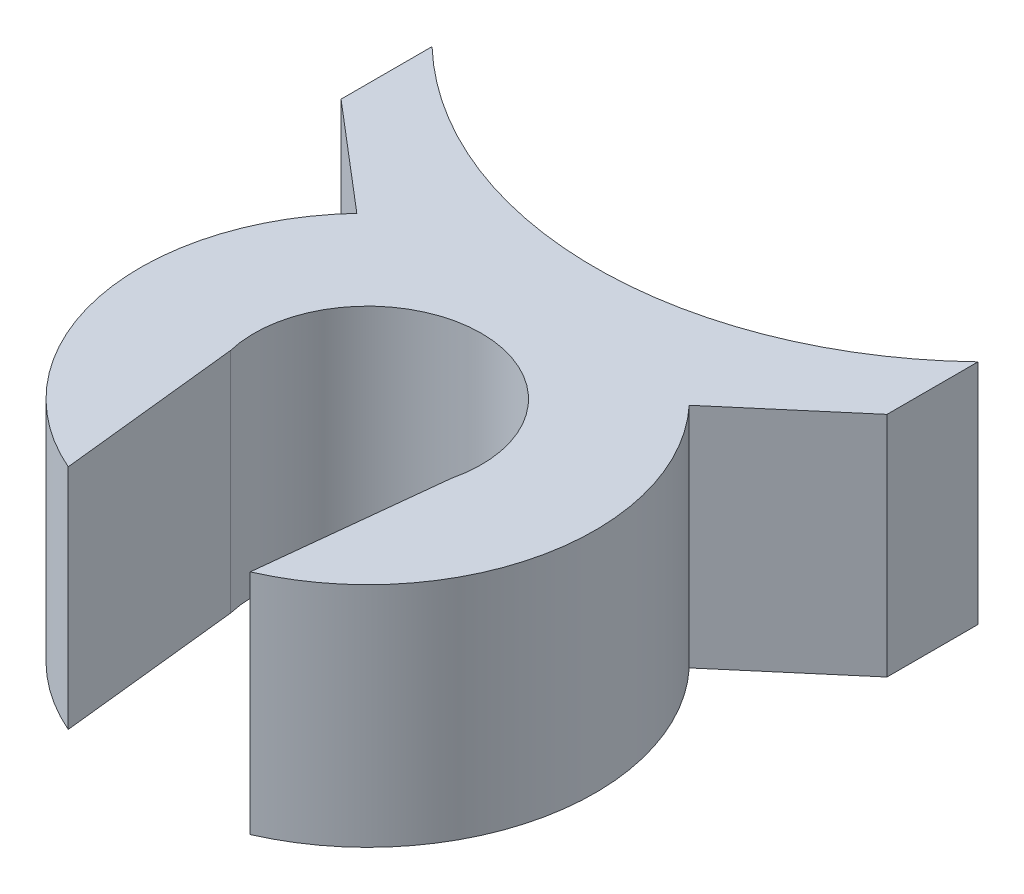
from build123d import *

# Parameters (mm, degrees)
CROQUIS1_R              = 2.5
SALIENTE_EXTRUIR1_DEPTH = 5
CORTAR_EXTRUIR1_START   = -10
CORTAR_EXTRUIR1_DEPTH   = 10
CORTAR_EXTRUIR2_DEPTH   = 10


with BuildPart() as part:
    # Croquis1 → Saliente-Extruir1 (new body)
    with BuildSketch(Plane(origin=(0, 0, 0), x_dir=(1, 0, 0), z_dir=(0, 1, 0))):
        with BuildLine():
            Line((-6, 7.413947971), (-6, 3.413947971))
            Line((-6, 3.413947971), (-3.653075314, 3.413947971))
            ThreePointArc((-3.653075314, 3.413947971), (0, -5), (3.653075314, 3.413947971))
            Line((3.653075314, 3.413947971), (6, 3.413947971))
            Line((6, 3.413947971), (6, 7.413947971))
            ThreePointArc((6, 7.413947971), (0, 5), (-6, 7.413947971))
        make_face()
        with Locations(Location((0, 0, 0), (0, 0, 270))):
            Circle(CROQUIS1_R, mode=Mode.SUBTRACT)
    extrude(amount=SALIENTE_EXTRUIR1_DEPTH)

    # Croquis2 → Cortar-Extruir1 (cut)
    with BuildSketch(Plane(origin=(0, 5, 0), x_dir=(1, 0, 0), z_dir=(0, 1, 0)).offset(CORTAR_EXTRUIR1_START)):
        with BuildLine():
            ThreePointArc((2.4311737, -0.582575695), (1.548153862, -1.96296195), (0, -2.5))
            Line((0, -2.5), (0, -5))
            ThreePointArc((0, -5), (1.021548218, -4.894531565), (2, -4.582575695))
            Line((2, -4.582575695), (2.4311737, -0.582575695))
        make_face()
        with BuildLine():
            Line((0, -5), (0, -2.5))
            ThreePointArc((0, -2.5), (-1.548153862, -1.96296195), (-2.4311737, -0.582575695))
            Line((-2.4311737, -0.582575695), (-2, -4.582575695))
            ThreePointArc((-2, -4.582575695), (-1.021548218, -4.894531565), (0, -5))
        make_face()
    extrude(amount=CORTAR_EXTRUIR1_DEPTH, mode=Mode.SUBTRACT)

    # Croquis3 → Cortar-Extruir2 (cut)
    with BuildSketch(Plane(origin=(0, 5, 0), x_dir=(1, 0, 0), z_dir=(0, 1, 0))):
        Polygon((3.653075314, 3.413947971), (6, 5.413947971), (6, 3.413947971), align=None)
        Polygon((-3.653075314, 3.413947971), (-6, 5.413947971), (-6, 3.413947971), align=None)
    extrude(amount=-CORTAR_EXTRUIR2_DEPTH, mode=Mode.SUBTRACT)


solid = part.part
